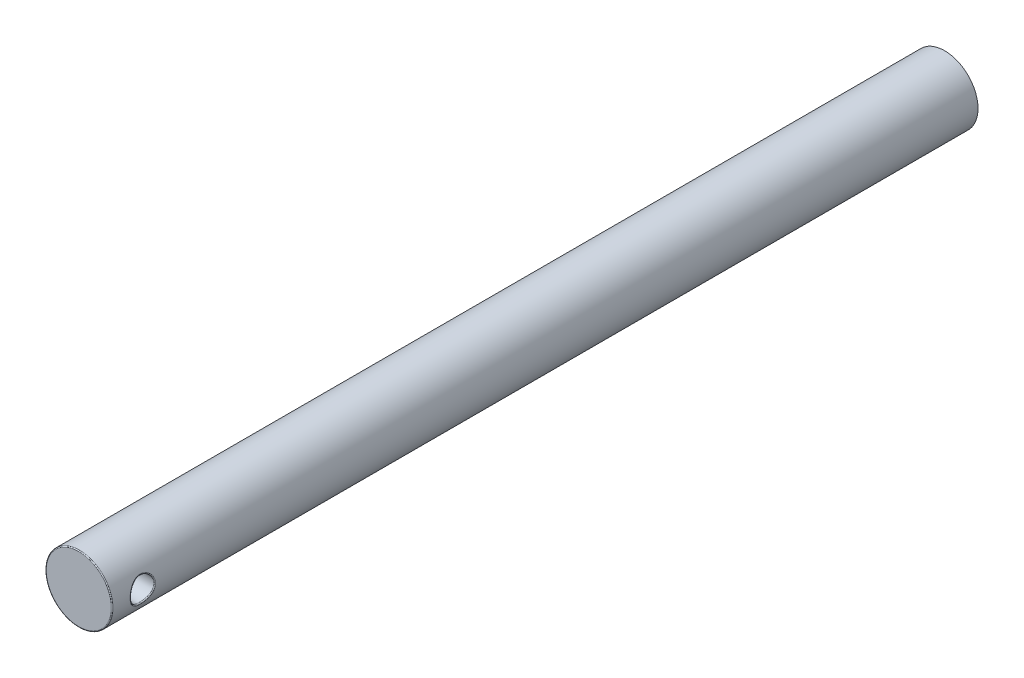
from build123d import *

# Parameters (mm, degrees)
SKETCH1_R           = 9.779
BOSS_EXTRUDE1_DEPTH = 254
SKETCH2_R           = 3.4925
CUT_EXTRUDE1_DEPTH  = 258.43167062
FILLET1_R           = 0.254
FILLET2_R           = 0.254


with BuildPart() as part:
    # Sketch1 → Boss-Extrude1 (new body)
    with BuildSketch(Plane.XY):
        with Locations((20.0025, 19.685)):
            Circle(SKETCH1_R)
    extrude(amount=BOSS_EXTRUDE1_DEPTH)

    # Sketch2 → Cut-Extrude1 (cut, through all)
    with BuildSketch(Plane(origin=(0, 0, 0), x_dir=(0, 0, -1), z_dir=(1, 0, 0))):
        with Locations(Location((-244.983, 19.685, 0), (0, 0, 180))):
            Circle(SKETCH2_R)
    extrude(amount=CUT_EXTRUDE1_DEPTH, mode=Mode.SUBTRACT)

    # Fillet1
    fillet1_edges = [part.edges().sort_by_distance(p)[0] for p in [
        (29.136572736, 23.1775, 244.983),
        (10.2235, 19.685, 241.490499999),
    ]]
    fillet(fillet1_edges, radius=FILLET1_R)

    # Fillet2
    fillet2_edges = [part.edges().sort_by_distance(p)[0] for p in [
        (10.2235, 19.685, 254),
    ]]
    fillet(fillet2_edges, radius=FILLET2_R)


solid = part.part
